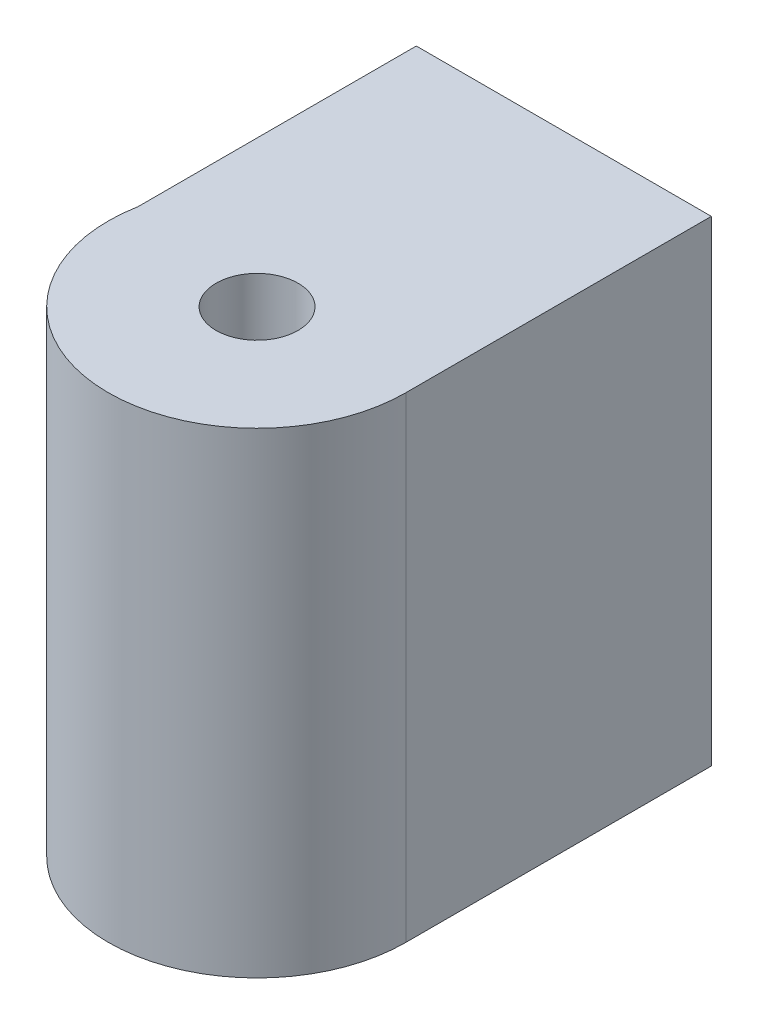
from build123d import *

# Parameters (mm, degrees)
SKETCH2_R                                      = 12.7
BOSS_EXTRUDE6_DEPTH                            = 40.64
SKETCH3_R                                      = 3.5
CUT_EXTRUDE1_DEPTH                             = 40.64
SKETCH4_R                                      = 1.778
CUT_EXTRUDE2_DEPTH                             = 6
BOSS_EXTRUDE8_DEPTH                            = 10
SKETCH8_W                                      = 25.185693912
SKETCH8_H                                      = 10
BOSS_EXTRUDE9_DEPTH                            = 7.284789049
BOSS_EXTRUDE10_DEPTH                           = 30.64
CSK_FOR_M3_FLAT_HEAD_MACHINE_SCREW1_AT_2_COUNT = 2
CSK_FOR_M3_FLAT_HEAD_MACHINE_SCREW1_AT_2_PITCH = 9.039543014
CSK_FOR_M3_FLAT_HEAD_MACHINE_SCREW1_AT_3_COUNT = 2
CSK_FOR_M3_FLAT_HEAD_MACHINE_SCREW1_AT_3_PITCH = 9.039543014


with BuildPart() as part:
    # Sketch2 → Boss-Extrude6 (new body)
    with BuildSketch(Plane(origin=(0, -2111.389926236, 0), x_dir=(1, 0, 0), z_dir=(0, 1, 0))):
        with Locations(Location((-53.693967541, 163.840329354, 0), (0, 0, 180))):
            Circle(SKETCH2_R)
    extrude(amount=BOSS_EXTRUDE6_DEPTH)

    # Sketch3 → Cut-Extrude1 (cut)
    with BuildSketch(Plane(origin=(0, -2070.749926236, 0), x_dir=(1, 0, 0), z_dir=(0, 1, 0))):
        with Locations(Location((-53.693967541, 163.840329354, 0), (0, 0, 270))):
            Circle(SKETCH3_R)
    extrude(amount=-CUT_EXTRUDE1_DEPTH, mode=Mode.SUBTRACT)

    # Sketch4 → Cut-Extrude2 (cut)
    with BuildSketch(Plane.XZ.offset(2111.389926236)):
        with Locations(Location((-61.942859512, -159.077829354, 0), (0, 0, 270))):
            Circle(SKETCH4_R)
        with Locations(Location((-53.693967541, -173.365329354, 0), (0, 0, 270))):
            Circle(SKETCH4_R)
        with Locations(Location((-45.44507557, -159.077829354, 0), (0, 0, 270))):
            Circle(SKETCH4_R)
    extrude(amount=-CUT_EXTRUDE2_DEPTH, mode=Mode.SUBTRACT)

    # Sketch7 → Boss-Extrude8 (add)
    with BuildSketch(Plane.XZ.offset(2111.389926236)):
        with BuildLine():
            Line((-40.993967541, -163.840329354), (-40.993967541, -182.634287878))
            Line((-40.993967541, -182.634287878), (-66.179661453, -182.634287878))
            Line((-66.179661453, -182.634287878), (-66.179661453, -166.163570095))
            ThreePointArc((-66.179661453, -166.163570095), (-52.527415502, -176.486639343), (-40.993967541, -163.840329354))
        make_face()
    extrude(amount=-BOSS_EXTRUDE8_DEPTH)

    # Sketch8 → Boss-Extrude9 (add)
    with BuildSketch(Plane(origin=(0, 0, -182.634287878), x_dir=(-1, 0, 0), z_dir=(0, 0, -1))):
        with Locations((53.586814497, -2106.389926236)):
            Rectangle(SKETCH8_W, SKETCH8_H)
    extrude(amount=BOSS_EXTRUDE9_DEPTH)

    # Sketch9 → Boss-Extrude10 (add)
    with BuildSketch(Plane(origin=(0, -2070.749926236, 0), x_dir=(1, 0, 0), z_dir=(0, 1, 0))):
        with BuildLine():
            Line((-66.179661453, 163.840329354), (-66.179661453, 189.919076927))
            Line((-66.179661453, 189.919076927), (-40.993967541, 189.919076927))
            Line((-40.993967541, 189.919076927), (-40.993967541, 163.840329354))
            ThreePointArc((-40.993967541, 163.840329354), (-53.586814497, 176.43317631), (-66.179661453, 163.840329354))
        make_face()
    extrude(amount=-BOSS_EXTRUDE10_DEPTH)

    # Sketch15 → CSK for M3 Flat Head Machine Screw1 (revolve, cut)
    with BuildSketch(Plane(origin=(-53.586814498, -2075.749926236, -189.919076927), x_dir=(0, 1, 0), z_dir=(1, 0, 0))):
        Polygon((0, 0), (0, 10), (1.7, 8.978536948), (1.7, 1.45), (3.15, 0), align=None)
    csk_for_m3_flat_head_machine_screw1 = revolve(axis=Axis((-53.586814498, -2075.749926236, -196.269076927), (0, 0, 1)), mode=Mode.SUBTRACT)

    # CSK for M3 Flat Head Machine Screw1 at 2: CSK for M3 Flat Head Machine Screw1 ×2
    with Locations(*[(-i * CSK_FOR_M3_FLAT_HEAD_MACHINE_SCREW1_AT_2_PITCH, 0, 0) for i in range(1, CSK_FOR_M3_FLAT_HEAD_MACHINE_SCREW1_AT_2_COUNT)]):
        add(csk_for_m3_flat_head_machine_screw1, mode=Mode.SUBTRACT)

    # CSK for M3 Flat Head Machine Screw1 at 3: CSK for M3 Flat Head Machine Screw1 ×2
    with Locations(*[(i * CSK_FOR_M3_FLAT_HEAD_MACHINE_SCREW1_AT_3_PITCH, 0, 0) for i in range(1, CSK_FOR_M3_FLAT_HEAD_MACHINE_SCREW1_AT_3_COUNT)]):
        add(csk_for_m3_flat_head_machine_screw1, mode=Mode.SUBTRACT)

    # Mirror1: CSK for M3 Flat Head Machine Screw1 across plane
    add(csk_for_m3_flat_head_machine_screw1.mirror(Plane.ZX.offset(-2091.069926234)), mode=Mode.SUBTRACT)

    # Mirror1 copy 1 sketch → Mirror1 copy 1 (revolve, cut)
    with BuildSketch(Plane(origin=(-62.626357512, -2106.389926232, -189.919076927), x_dir=(0, -1, 0), z_dir=(1, 0, 0))):
        Polygon((0, 0), (0, -10), (1.7, -8.978536948), (1.7, -1.45), (3.15, 0), align=None)
    revolve(axis=Axis((-62.626357512, -2106.389926232, -196.269076927), (0, 0, -1)), mode=Mode.SUBTRACT)

    # Mirror1 copy 2 sketch → Mirror1 copy 2 (revolve, cut)
    with BuildSketch(Plane(origin=(-44.547271484, -2106.389926232, -189.919076927), x_dir=(0, -1, 0), z_dir=(1, 0, 0))):
        Polygon((0, 0), (0, -10), (1.7, -8.978536948), (1.7, -1.45), (3.15, 0), align=None)
    revolve(axis=Axis((-44.547271484, -2106.389926232, -196.269076927), (0, 0, -1)), mode=Mode.SUBTRACT)


solid = part.part
